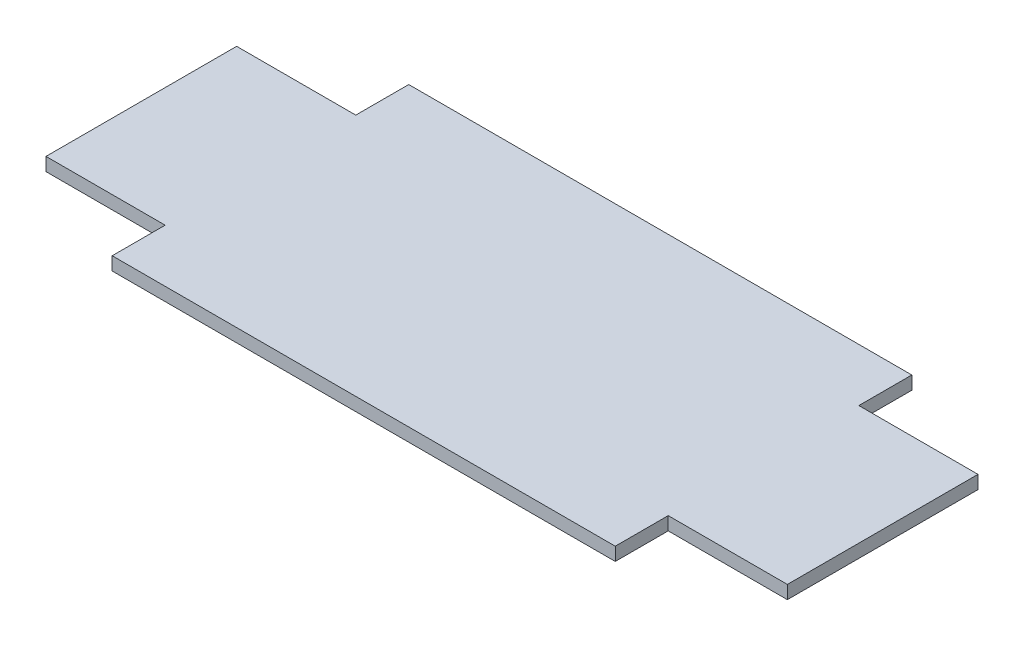
from build123d import *

# Parameters (mm, degrees)
BOSS_EXTRUDE1_DEPTH = 5


with BuildPart() as part:
    # Sketch1 → Boss-Extrude1 (new body)
    with BuildSketch(Plane(origin=(0, 0, 0), x_dir=(1, 0, 0), z_dir=(0, 1, 0))):
        Polygon((45, 0), (235, 0), (235, -20), (280, -20), (280, -92), (235, -92), (235, -112), (45, -112), (45, -92), (0, -92), (0, -20), (45, -20), align=None)
    extrude(amount=BOSS_EXTRUDE1_DEPTH)


solid = part.part
